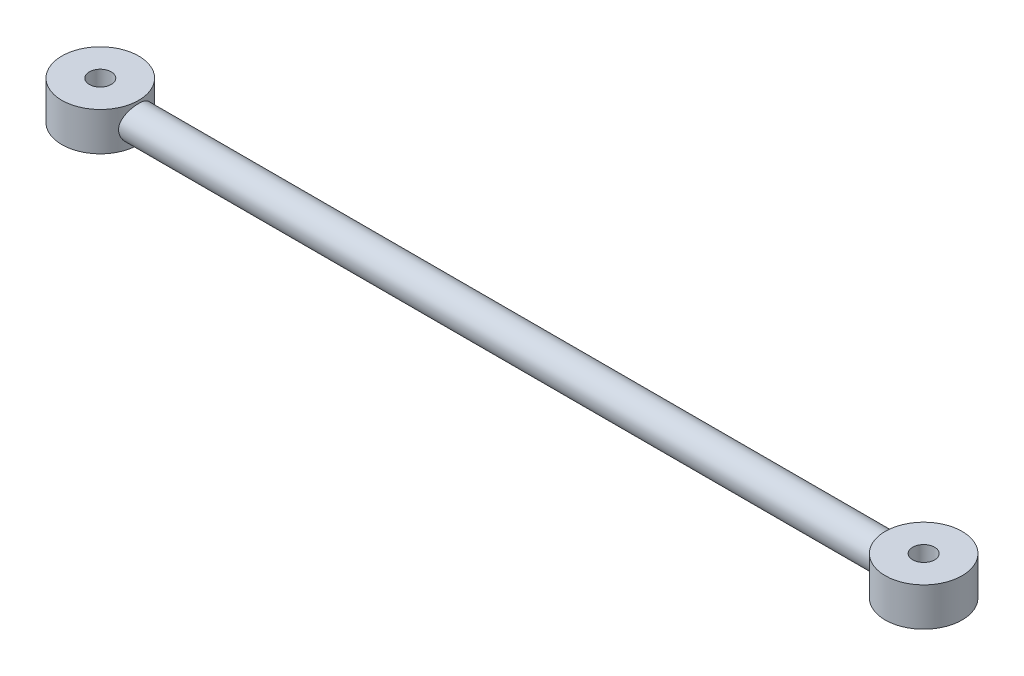
from build123d import *

# Parameters (mm, degrees)
SKETCH1_R                            = 7
SKETCH1_R_2                          = 2
BOSS_EXTRUDE1_DEPTH                  = 7
BOSS_EXTRUDE1_2_DEPTH                = 7
BOSS_EXTRUDE2_REACH                  = 136.864
BOSS_EXTRUDE2_END_RADIUS             = 7
SKETCH2_R                            = 3
BOSS_EXTRUDE2_DIRECTION_2_REACH      = 136.864
BOSS_EXTRUDE2_DIRECTION_2_END_RADIUS = 7


with BuildPart() as part:
    # Sketch1 → Boss-Extrude1 (new body)
    with BuildSketch(Plane(origin=(0, 0, 0), x_dir=(1, 0, 0), z_dir=(0, 1, 0))):
        with Locations(Location((0, 0, 0), (0, 0, 270))):
            Circle(SKETCH1_R)
        with Locations(Location((0, 0, 0), (0, 0, 270))):
            Circle(SKETCH1_R_2, mode=Mode.SUBTRACT)
    extrude(amount=BOSS_EXTRUDE1_DEPTH)



with BuildPart() as body_2:
    # Sketch1 → Boss-Extrude1 2 (new body)
    with BuildSketch(Plane(origin=(0, 0, 0), x_dir=(1, 0, 0), z_dir=(0, 1, 0))):
        with Locations(Location((150, 0, 0), (0, 0, 270))):
            Circle(SKETCH1_R)
        with Locations(Location((150, 0, 0), (0, 0, 270))):
            Circle(SKETCH1_R_2, mode=Mode.SUBTRACT)
    extrude(amount=BOSS_EXTRUDE1_2_DEPTH)


with BuildPart() as part_1:
    add(part.part)

    add(body_2.part)  # Boss-Extrude2 merges body 2
    # Boss-Extrude2: up to this cylinder (the profile starts outside it)
    boss_extrude2_end = Plane(origin=(150, 3.5, 0), z_dir=(0, -1, 0)) * Cylinder(BOSS_EXTRUDE2_END_RADIUS, 288.728, mode=Mode.PRIVATE)
    # Sketch2 → Boss-Extrude2 (add, up to the surface)
    with BuildSketch(Plane(origin=(22.5, 0, 0), x_dir=(0, 0, -1), z_dir=(1, 0, 0)), mode=Mode.PRIVATE) as boss_extrude2_sk1:
        with Locations(Location((0, 3.5, 0), (0, 0, 180))):
            Circle(SKETCH2_R)
    boss_extrude2_tool1 = extrude(boss_extrude2_sk1.sketch, amount=BOSS_EXTRUDE2_REACH, mode=Mode.PRIVATE) - boss_extrude2_end
    add(boss_extrude2_tool1.solids().sort_by_distance((22.5, 3.5, 0))[0])

    # Boss-Extrude2 direction 2: up to this cylinder (the profile starts outside it)
    boss_extrude2_direction_2_end = Plane(origin=(0, 3.5, 0), z_dir=(0, -1, 0)) * Cylinder(BOSS_EXTRUDE2_DIRECTION_2_END_RADIUS, 288.728, mode=Mode.PRIVATE)
    # Sketch2 → Boss-Extrude2 direction 2 (add, up to the surface)
    with BuildSketch(Plane(origin=(22.5, 0, 0), x_dir=(0, 0, -1), z_dir=(1, 0, 0)), mode=Mode.PRIVATE) as boss_extrude2_direction_2_sk1:
        with Locations(Location((0, 3.5, 0), (0, 0, 180))):
            Circle(SKETCH2_R)
    boss_extrude2_direction_2_tool1 = extrude(boss_extrude2_direction_2_sk1.sketch, amount=-BOSS_EXTRUDE2_DIRECTION_2_REACH, mode=Mode.PRIVATE) - boss_extrude2_direction_2_end
    add(boss_extrude2_direction_2_tool1.solids().sort_by_distance((22.5, 3.5, 0))[0])


solid = part_1.part
